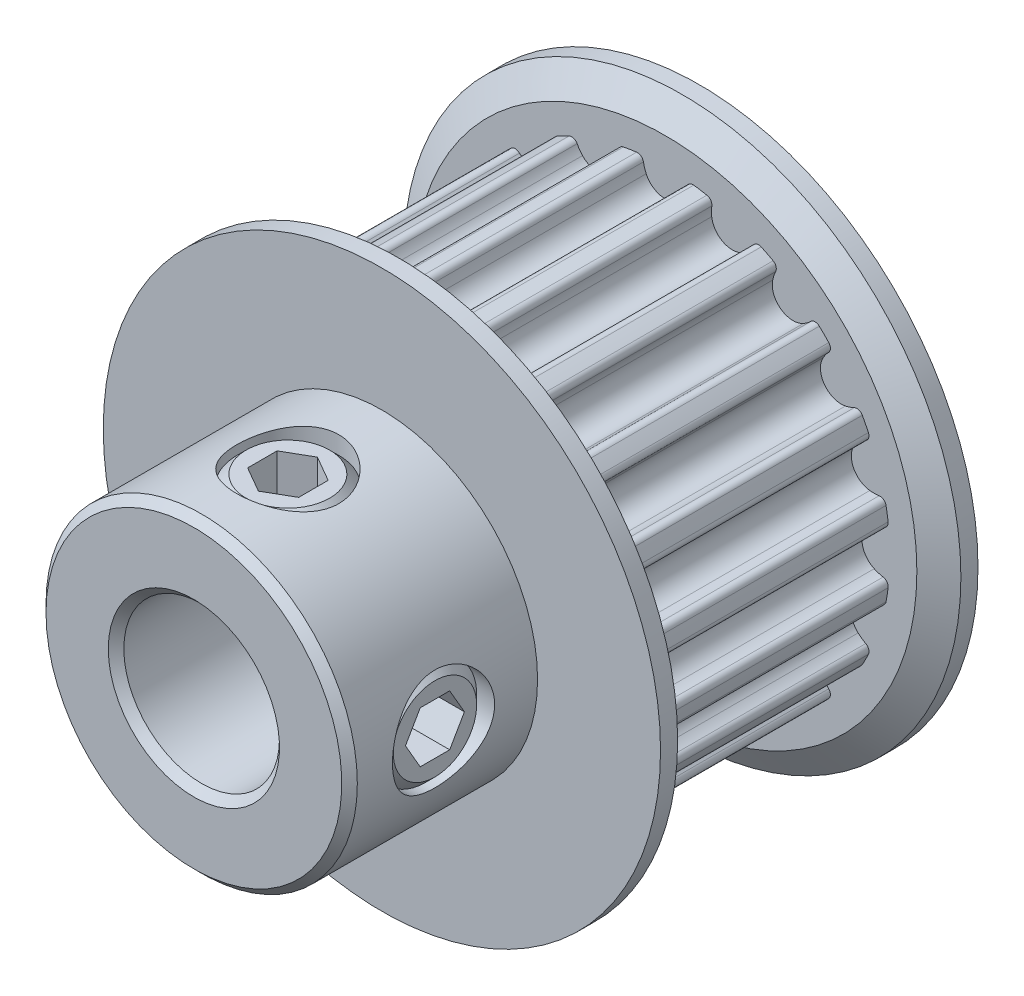
from build123d import *

# Parameters (mm, degrees)
CUT_EXTRUDE1_START = 1.245
CUT_EXTRUDE1_DEPTH = 10.16
CIRPATTERN1_COUNT  = 20
SKETCH4_R          = 2.0828
CUT_EXTRUDE2_DEPTH = 20.096877873
CUT_EXTRUDE3_DEPTH = 1.5621
CIRPATTERN2_COUNT  = 2
CIRPATTERN2_ANGLE  = 90
CHAMFER1_SIZE      = 0.3175


with BuildPart() as part:
    # Sketch2 → Revolve1 (revolve)
    with BuildSketch(Plane(origin=(0, 0, 0), x_dir=(0, 0, -1), z_dir=(1, 0, 0)), mode=Mode.PRIVATE) as revolve1_sk:
        Polygon((-10.31, 3.175), (10.31, 3.175), (10.31, 11.3665), (9.6125, 11.3665), (8.915, 10.268), (8.915, 9.1695), (-1.245, 9.1695), (-1.245, 10.268), (-1.9425, 11.3665), (-2.64, 11.3665), (-2.64, 6.35), (-10.31, 6.35), align=None)
    revolve(revolve1_sk.sketch.rotate(Axis((0, 0, 10.31), (0, 0, -1)), 90), axis=Axis((0, 0, 10.31), (0, 0, -1)))

    # Sketch3 → Cut-Extrude1 (cut)
    with BuildSketch(Plane.XY.offset(CUT_EXTRUDE1_START)):
        with BuildLine():
            Line((3.709120542, 11.3665), (-3.709120542, 11.3665))
            Line((-3.709120542, 11.3665), (-2.844572999, 8.717117339))
            ThreePointArc((-2.844572999, 8.717117339), (-2.013436622, 8.945714238), (-1.164506748, 9.095254493))
            ThreePointArc((-1.164506748, 9.095254493), (-0.984686536, 9.048711247), (-0.886605127, 8.89097216))
            ThreePointArc((-0.886605127, 8.89097216), (-0.841637456, 8.705907931), (-0.773880597, 8.527919538))
            ThreePointArc((-0.773880597, 8.527919538), (0, 8.0295), (0.773880597, 8.527919538))
            ThreePointArc((0.773880597, 8.527919538), (0.841637456, 8.705907931), (0.886605127, 8.89097216))
            ThreePointArc((0.886605127, 8.89097216), (0.984686536, 9.048711247), (1.164506748, 9.095254493))
            ThreePointArc((1.164506748, 9.095254493), (2.013436622, 8.945714238), (2.844572999, 8.717117339))
            Line((2.844572999, 8.717117339), (3.709120542, 11.3665))
        make_face()
    cut_extrude1 = extrude(amount=-CUT_EXTRUDE1_DEPTH, mode=Mode.SUBTRACT)

    # CirPattern1: Cut-Extrude1 ×20 about axis
    cirpattern1_axis = Axis((0, 0, 0), (0, 0, 1))
    for i in range(1, CIRPATTERN1_COUNT):
        add(cut_extrude1.rotate(cirpattern1_axis, i * 360 / CIRPATTERN1_COUNT), mode=Mode.SUBTRACT)

    # Sketch4 → Cut-Extrude2 (cut, through all)
    with BuildSketch(Plane(origin=(0, 0, 0), x_dir=(0, -1, 0), z_dir=(1, 0, 0))):
        with Locations(Location((0, -6.475, 0), (0, 0, 270))):
            Circle(SKETCH4_R)
    cut_extrude2 = extrude(amount=CUT_EXTRUDE2_DEPTH, mode=Mode.SUBTRACT)

    # Sketch5 → Revolve2 (revolve)
    with BuildSketch(Plane.XY.offset(6.475)):
        Polygon((3.175, -1.7018), (3.175, 0), (5.99870354, 0), (5.99870354, -1.7018), (5.61770354, -2.0828), (3.556, -2.0828), align=None)
    revolve2 = revolve(axis=Axis((3.175, 0, 6.475), (1, 0, 0)))

    # Sketch6 → Cut-Extrude3 (cut)
    with BuildSketch(Plane(origin=(5.99870354, 5.384140679, 0), x_dir=(0, -1, 0), z_dir=(-1, 0, 0))):
        Polygon((5.384140679, 7.677505141), (4.342740679, 7.07625257), (4.342740679, 5.87374743), (5.384140679, 5.272494859), (6.425540679, 5.87374743), (6.425540679, 7.07625257), align=None)
    cut_extrude3 = extrude(amount=CUT_EXTRUDE3_DEPTH, mode=Mode.SUBTRACT)

    # CirPattern2: Cut-Extrude2, Revolve2, Cut-Extrude3 ×2 about axis
    cirpattern2_axis = Axis((0, 0, 0), (0, 0, 1))
    add([cut_extrude2.rotate(cirpattern2_axis, i * CIRPATTERN2_ANGLE / (CIRPATTERN2_COUNT - 1)) for i in range(1, CIRPATTERN2_COUNT)], mode=Mode.SUBTRACT)
    add([revolve2.rotate(cirpattern2_axis, i * CIRPATTERN2_ANGLE / (CIRPATTERN2_COUNT - 1)) for i in range(1, CIRPATTERN2_COUNT)])
    add([cut_extrude3.rotate(cirpattern2_axis, i * CIRPATTERN2_ANGLE / (CIRPATTERN2_COUNT - 1)) for i in range(1, CIRPATTERN2_COUNT)], mode=Mode.SUBTRACT)

    # Chamfer1
    chamfer1_edges = [part.edges().sort_by_distance(p)[0] for p in [
        (-6.35, 0, 10.31),
        (-3.175, 0, 10.31),
    ]]
    chamfer(chamfer1_edges, length=CHAMFER1_SIZE)


solid = part.part
